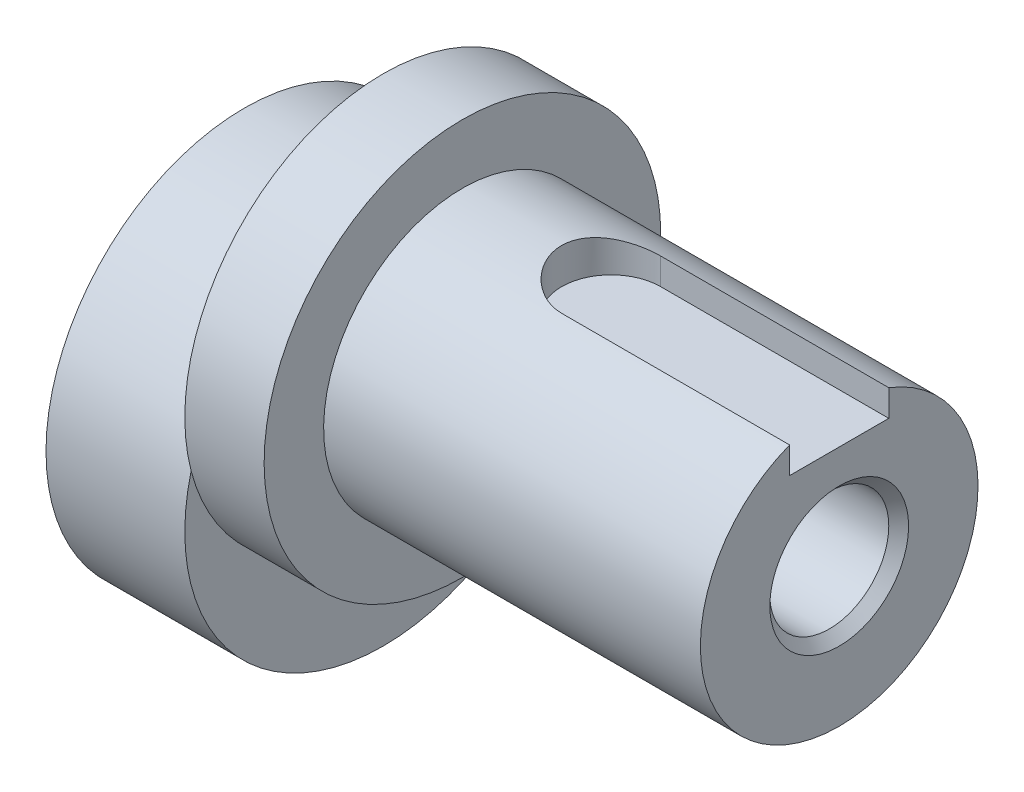
from build123d import *

# Parameters (mm, degrees)
SKETCH1_R           = 10
BOSS_EXTRUDE1_DEPTH = 7
SKETCH2_R           = 10
BOSS_EXTRUDE2_DEPTH = 4
SKETCH3_R           = 7
BOSS_EXTRUDE3_DEPTH = 19
SKETCH4_R           = 3
CUT_EXTRUDE1_DEPTH  = 36
CHAMFER1_SIZE       = 0.5
CUT_EXTRUDE2_START  = 10.2
CUT_EXTRUDE2_DEPTH  = 25.8


with BuildPart() as part:
    # Sketch1 → Boss-Extrude1 (new body)
    with BuildSketch(Plane(origin=(0, 0, 0), x_dir=(0, 0, -1), z_dir=(1, 0, 0))):
        Circle(SKETCH1_R)
    extrude(amount=BOSS_EXTRUDE1_DEPTH)

    # Sketch2 → Boss-Extrude2 (add)
    with BuildSketch(Plane(origin=(7, 0, 0), x_dir=(0, 0, -1), z_dir=(1, 0, 0))):
        with Locations(Location((0, 5, 0), (0, 0, 194.477512186))):
            Circle(SKETCH2_R)
    extrude(amount=BOSS_EXTRUDE2_DEPTH)

    # Sketch3 → Boss-Extrude3 (add)
    with BuildSketch(Plane(origin=(11, 0, 0), x_dir=(0, 0, -1), z_dir=(1, 0, 0))):
        with Locations((0, 5)):
            Circle(SKETCH3_R)
    extrude(amount=BOSS_EXTRUDE3_DEPTH)

    # Sketch4 → Cut-Extrude1 (cut, through all)
    with BuildSketch(Plane(origin=(30, 0, 0), x_dir=(0, 0, -1), z_dir=(1, 0, 0))):
        with Locations((0, 5)):
            Circle(SKETCH4_R)
    extrude(amount=-CUT_EXTRUDE1_DEPTH, mode=Mode.SUBTRACT)

    # Chamfer1
    chamfer1_edges = [part.edges().sort_by_distance(p)[0] for p in [
        (0, 5, 3),
        (30, 5, 3),
    ]]
    chamfer(chamfer1_edges, length=CHAMFER1_SIZE)

    # Sketch5 → Cut-Extrude2 (cut, through all)
    with BuildSketch(Plane(origin=(0, 0, 0), x_dir=(1, 0, 0), z_dir=(0, 1, 0)).offset(CUT_EXTRUDE2_START)):
        with BuildLine():
            Line((30, -2.5), (18.5, -2.5))
            ThreePointArc((18.5, -2.5), (16, 0), (18.5, 2.5))
            Line((18.5, 2.5), (30, 2.5))
            Line((30, 2.5), (31, 2.5))
            Line((31, 2.5), (31, -2.5))
            Line((31, -2.5), (30, -2.5))
        make_face()
    extrude(amount=CUT_EXTRUDE2_DEPTH, mode=Mode.SUBTRACT)


solid = part.part
